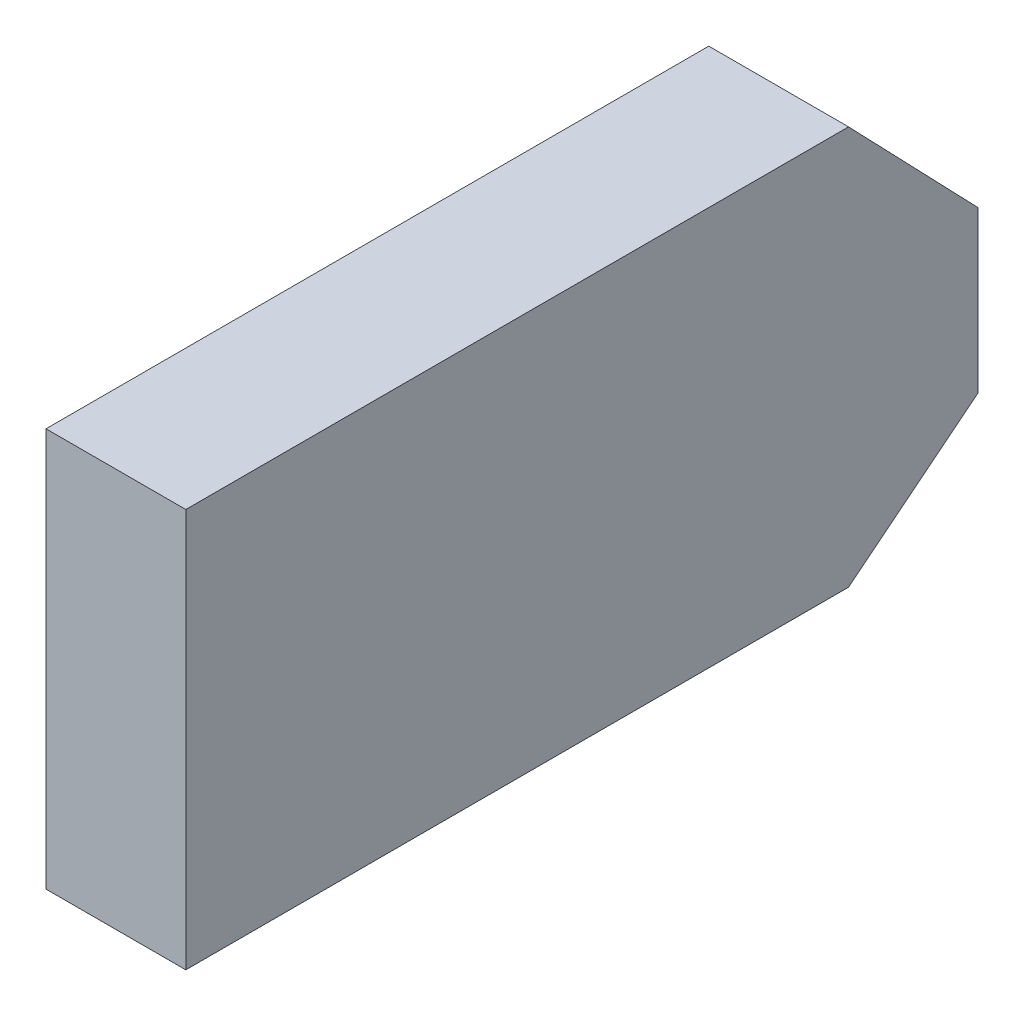
from build123d import *

# Parameters (mm, degrees)
BOSS_EXTRUDE1_DEPTH = 27


with BuildPart() as part:
    # Sketch2 → Boss-Extrude1 (new body)
    with BuildSketch(Plane(origin=(0, 0, 0), x_dir=(0, 0, -1), z_dir=(1, 0, 0))):
        Polygon((0, 0), (0, 77), (128, 77), (153, 51), (153, 20), (128, 0), align=None)
    extrude(amount=BOSS_EXTRUDE1_DEPTH)


solid = part.part
